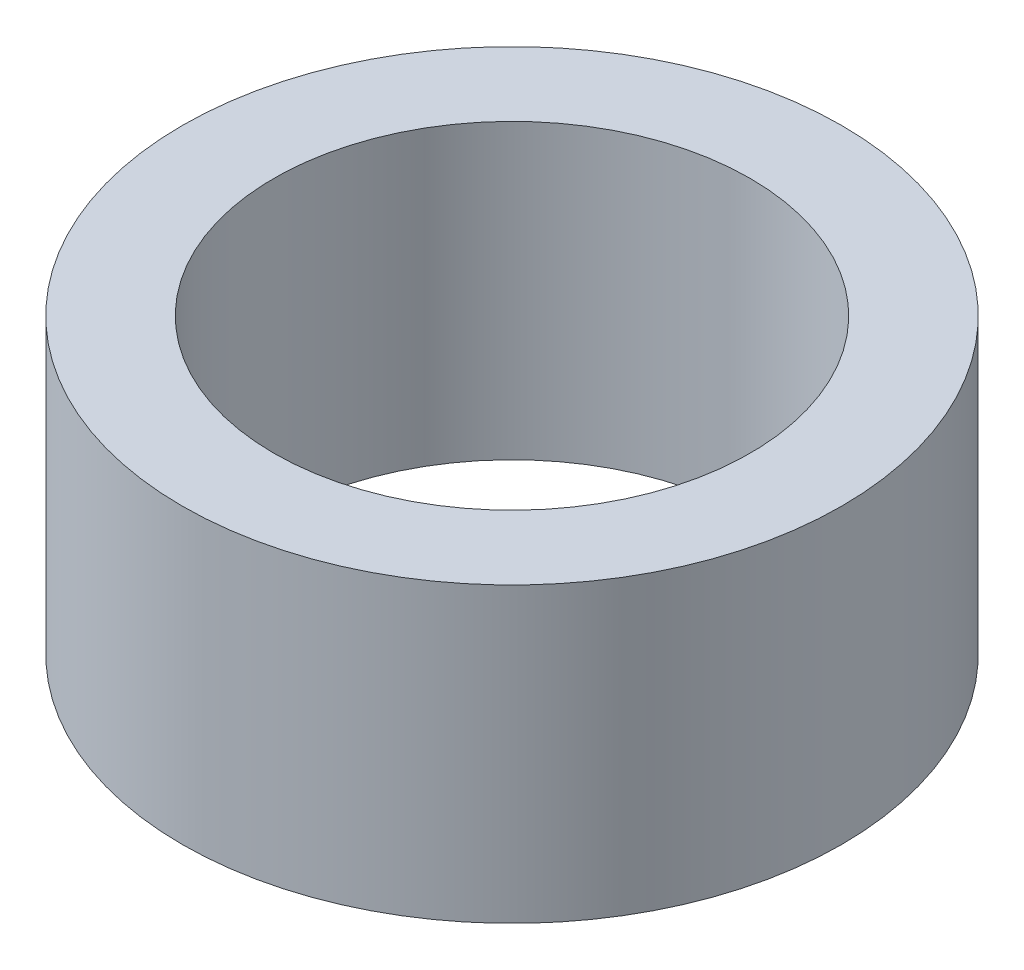
from build123d import *

# Parameters (mm, degrees)
SKETCH1_R           = 9
SKETCH1_R_2         = 6.5
BOSS_EXTRUDE1_DEPTH = 8


with BuildPart() as part:
    # Sketch1 → Boss-Extrude1 (new body)
    with BuildSketch(Plane(origin=(0, 0, 0), x_dir=(1, 0, 0), z_dir=(0, 1, 0))):
        with Locations(Location((0, 0, 0), (0, 0, 270))):
            Circle(SKETCH1_R)
        with Locations(Location((0, 0, 0), (0, 0, 270))):
            Circle(SKETCH1_R_2, mode=Mode.SUBTRACT)
    extrude(amount=BOSS_EXTRUDE1_DEPTH)


solid = part.part
